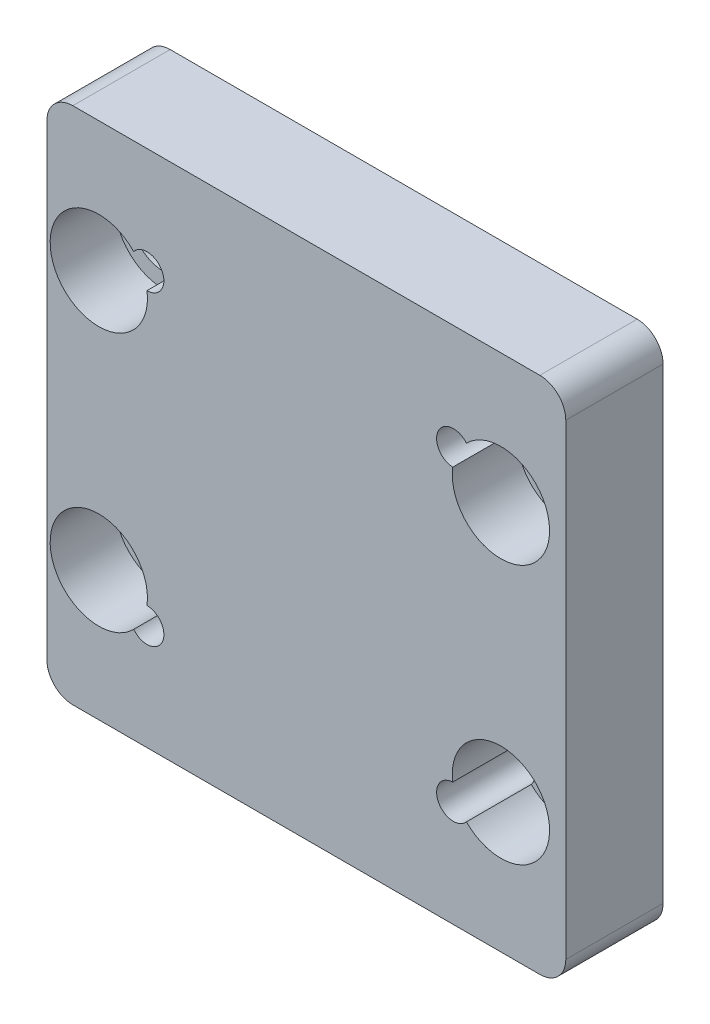
from build123d import *

# Parameters (mm, degrees)
SKETCH1_W                                        = 50.8
SKETCH1_H                                        = 50.8
BOSS_EXTRUDE1_DEPTH                              = 9.525
TAP_DRILL_FOR_M4X0_7_TAP1_D                      = 3.3
CBORE_FOR_1_4_SOCKET_HEAD_CAP_SCREW1_D           = 6.5278
CBORE_FOR_1_4_SOCKET_HEAD_CAP_SCREW1_CBORE_D     = 9.525
CBORE_FOR_1_4_SOCKET_HEAD_CAP_SCREW1_CBORE_DEPTH = 6.35
FILLET1_R                                        = 2.54


with BuildPart() as part:
    # Sketch1 → Boss-Extrude1 (new body)
    with BuildSketch(Plane.XY):
        with Locations((25.4, 25.4)):
            Rectangle(SKETCH1_W, SKETCH1_H)
    extrude(amount=BOSS_EXTRUDE1_DEPTH)

    # Tap Drill for M4x0.7 Tap1 (through all)
    with Locations(Plane.XY.offset(9.525)):
        with Locations((39.8, 10.4), (39.8, 40.4), (9.8, 40.4), (9.8, 10.4)):
            Hole(TAP_DRILL_FOR_M4X0_7_TAP1_D / 2)

    # CBORE for 1/4 Socket Head Cap Screw1 (through all)
    with Locations(Plane.XY.offset(9.525)):
        with Locations((44.45, 12.7), (44.45, 38.1), (5.08, 12.7), (5.08, 38.1)):
            CounterBoreHole(CBORE_FOR_1_4_SOCKET_HEAD_CAP_SCREW1_D / 2, CBORE_FOR_1_4_SOCKET_HEAD_CAP_SCREW1_CBORE_D / 2, CBORE_FOR_1_4_SOCKET_HEAD_CAP_SCREW1_CBORE_DEPTH)

    # Fillet1
    fillet1_edges = [part.edges().sort_by_distance(p)[0] for p in [
        (0, 50.8, 4.7625),
        (50.8, 50.8, 4.7625),
        (50.8, 0, 4.7625),
        (0, 0, 4.7625),
    ]]
    fillet(fillet1_edges, radius=FILLET1_R)


solid = part.part
